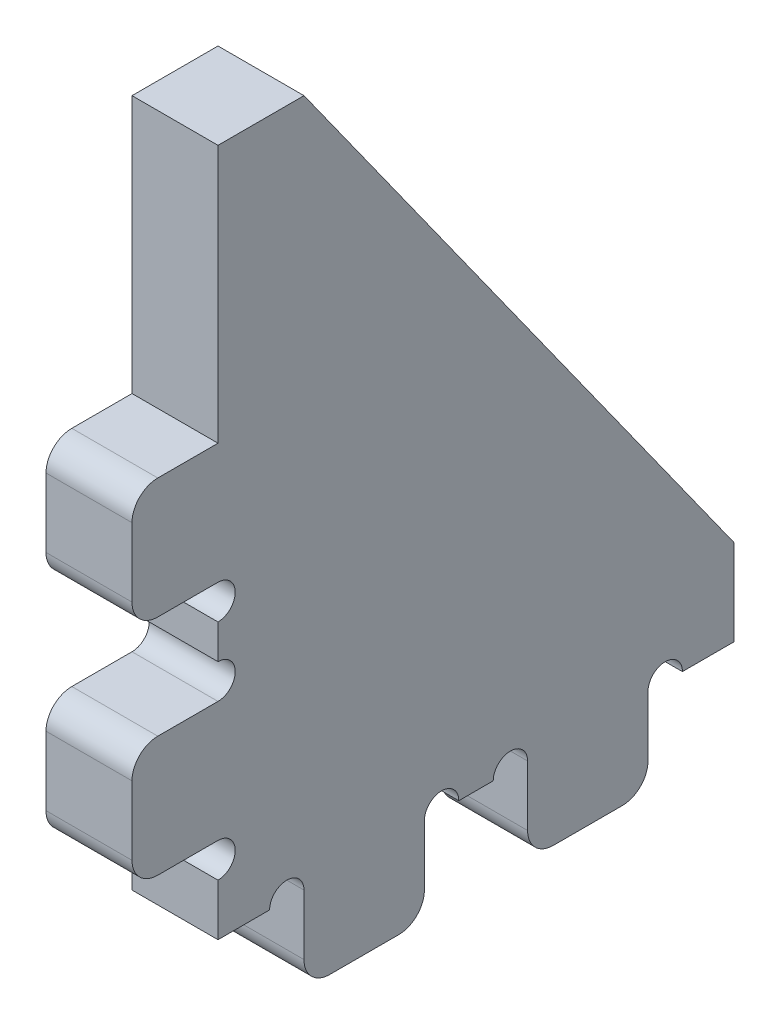
from build123d import *

# Parameters (mm, degrees)
EXTRUDE_1_DEPTH     = 5
SKETCH_2_W          = 7
SKETCH_2_H          = 5
SKETCH_2_W_2        = 5
SKETCH_2_H_2        = 7
EXTRUDE_2_DEPTH     = 5
SKETCH_3_R          = 1
CUT_EXTRUDE_1_DEPTH = 5
FILLET_1_R          = 1.5


with BuildPart() as part:
    # 스케치1 → 보스-돌출1 (new body)
    with BuildSketch(Plane(origin=(0, 0, 0), x_dir=(0, 0, -1), z_dir=(1, 0, 0))):
        Polygon((0, 0), (0, 40), (5, 40), (30, 5), (30, 0), align=None)
    extrude(amount=EXTRUDE_1_DEPTH)

    # 스케치2 → 보스-돌출2 (add)
    with BuildSketch(Plane(origin=(5, 0, 0), x_dir=(0, 0, -1), z_dir=(1, 0, 0))):
        with Locations((8.5, -2.5)):
            Rectangle(SKETCH_2_W, SKETCH_2_H)
        with Locations((21.5, -2.5)):
            Rectangle(SKETCH_2_W, SKETCH_2_H)
        with Locations((-2.5, 21.5)):
            Rectangle(SKETCH_2_W_2, SKETCH_2_H_2)
        with Locations((-2.5, 8.5)):
            Rectangle(SKETCH_2_W_2, SKETCH_2_H_2)
    extrude(amount=-EXTRUDE_2_DEPTH)

    # 스케치3 → 컷-돌출1 (cut)
    with BuildSketch(Plane(origin=(5, 0, 0), x_dir=(0, 0, -1), z_dir=(1, 0, 0))):
        with Locations((4, 0)):
            Circle(SKETCH_3_R)
        with Locations((13, 0)):
            Circle(SKETCH_3_R)
        with Locations((17, 0)):
            Circle(SKETCH_3_R)
        with Locations((26, 0)):
            Circle(SKETCH_3_R)
        with Locations((0, 4)):
            Circle(SKETCH_3_R)
        with Locations((0, 13)):
            Circle(SKETCH_3_R)
        with Locations((0, 17)):
            Circle(SKETCH_3_R)
    extrude(amount=-CUT_EXTRUDE_1_DEPTH, mode=Mode.SUBTRACT)

    # 필렛1
    fillet_1_edges = [part.edges().sort_by_distance(p)[0] for p in [
        (2.5, -5, -25),
        (2.5, -5, -12),
        (2.5, -5, -18),
        (2.5, 25, 5),
        (2.5, 18, 5),
        (2.5, -5, -5),
        (2.5, 5, 5),
        (2.5, 12, 5),
    ]]
    fillet(fillet_1_edges, radius=FILLET_1_R)


solid = part.part
